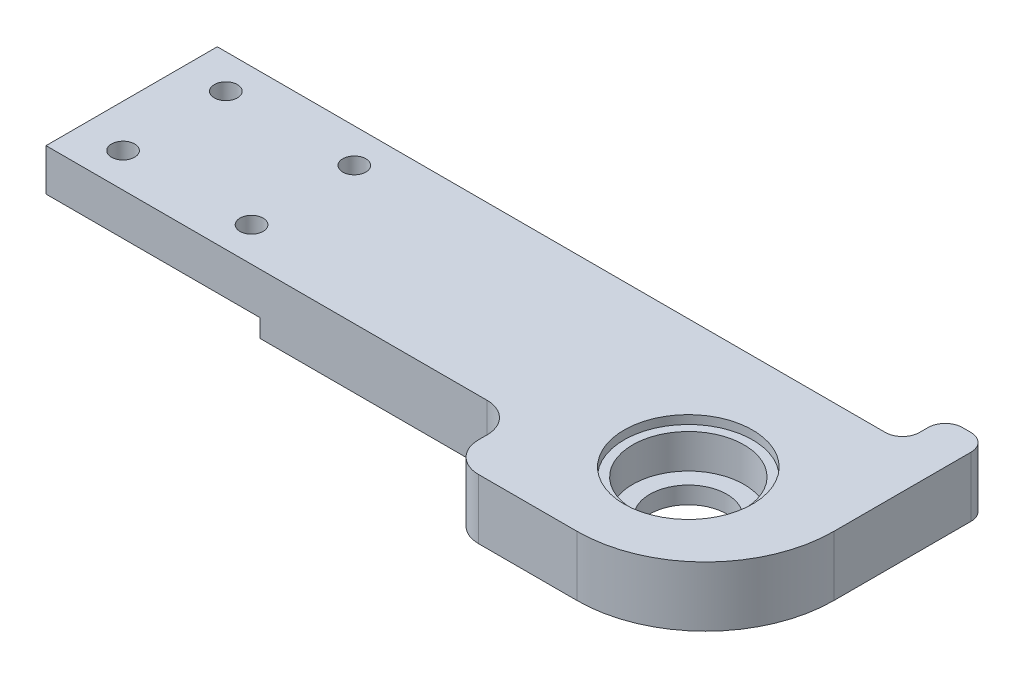
from build123d import *

# Parameters (mm, degrees)
SKETCH1_R           = 4.5
BOSS_EXTRUDE1_DEPTH = 7
SKETCH2_W           = 25
SKETCH2_H           = 20
CUT_EXTRUDE1_DEPTH  = 2.1
SKETCH3_R           = 1.35
CUT_EXTRUDE2_DEPTH  = 14
FILLET2_R           = 3.5
SKETCH4_R           = 7.5
CUT_EXTRUDE3_DEPTH  = 1
SKETCH5_R           = 6.5
CUT_EXTRUDE4_DEPTH  = 4
FILLET3_R           = 15
SKETCH6_W           = 5
SKETCH6_H           = 5
BOSS_EXTRUDE2_DEPTH = 7
FILLET4_R           = 2


with BuildPart() as part:
    # Sketch1 → Boss-Extrude1 (new body)
    with BuildSketch(Plane(origin=(0, 0, 0), x_dir=(1, 0, 0), z_dir=(0, 1, 0))):
        Polygon((0, 0), (55, 0), (55, -8), (85, -8), (85, 0), (85, 20), (0, 20), align=None)
        with Locations(Location((70, 5, 0), (0, 0, 270))):
            Circle(SKETCH1_R, mode=Mode.SUBTRACT)
    extrude(amount=BOSS_EXTRUDE1_DEPTH)

    # Sketch2 → Cut-Extrude1 (cut)
    with BuildSketch(Plane.XZ):
        with Locations((12.5, -10)):
            Rectangle(SKETCH2_W, SKETCH2_H)
    extrude(amount=-CUT_EXTRUDE1_DEPTH, mode=Mode.SUBTRACT)

    # Sketch3 → Cut-Extrude2 (cut)
    with BuildSketch(Plane.XZ.offset(-2.1)):
        with Locations(Location((5, -4, 0), (0, 0, 270))):
            Circle(SKETCH3_R)
        with Locations(Location((20, -4, 0), (0, 0, 270))):
            Circle(SKETCH3_R)
        with Locations(Location((20, -16, 0), (0, 0, 270))):
            Circle(SKETCH3_R)
        with Locations(Location((5, -16, 0), (0, 0, 270))):
            Circle(SKETCH3_R)
    extrude(amount=-CUT_EXTRUDE2_DEPTH, mode=Mode.SUBTRACT)

    # Fillet2
    fillet2_edges = [part.edges().sort_by_distance(p)[0] for p in [
        (55, 3.5, 8),
        (55, 3.5, 0),
    ]]
    fillet(fillet2_edges, radius=FILLET2_R)

    # Sketch4 → Cut-Extrude3 (cut)
    with BuildSketch(Plane(origin=(0, 7, 0), x_dir=(1, 0, 0), z_dir=(0, 1, 0))):
        with Locations(Location((70, 5, 0), (0, 0, 270))):
            Circle(SKETCH4_R)
    extrude(amount=-CUT_EXTRUDE3_DEPTH, mode=Mode.SUBTRACT)

    # Sketch5 → Cut-Extrude4 (cut)
    with BuildSketch(Plane(origin=(0, 6, 0), x_dir=(1, 0, 0), z_dir=(0, 1, 0))):
        with Locations(Location((70, 5, 0), (0, 0, 270))):
            Circle(SKETCH5_R)
    extrude(amount=-CUT_EXTRUDE4_DEPTH, mode=Mode.SUBTRACT)

    # Fillet3
    fillet3_edges = [part.edges().sort_by_distance(p)[0] for p in [
        (85, 3.5, 8),
    ]]
    fillet(fillet3_edges, radius=FILLET3_R)

    # Sketch6 → Boss-Extrude2 (add)
    with BuildSketch(Plane(origin=(0, 7, 0), x_dir=(1, 0, 0), z_dir=(0, 1, 0))):
        with Locations((82.5, 22.5)):
            Rectangle(SKETCH6_W, SKETCH6_H)
    extrude(amount=-BOSS_EXTRUDE2_DEPTH)

    # Fillet4
    fillet4_edges = [part.edges().sort_by_distance(p)[0] for p in [
        (80, 3.5, -25),
        (80, 3.5, -20),
        (85, 3.5, -25),
    ]]
    fillet(fillet4_edges, radius=FILLET4_R)


solid = part.part
